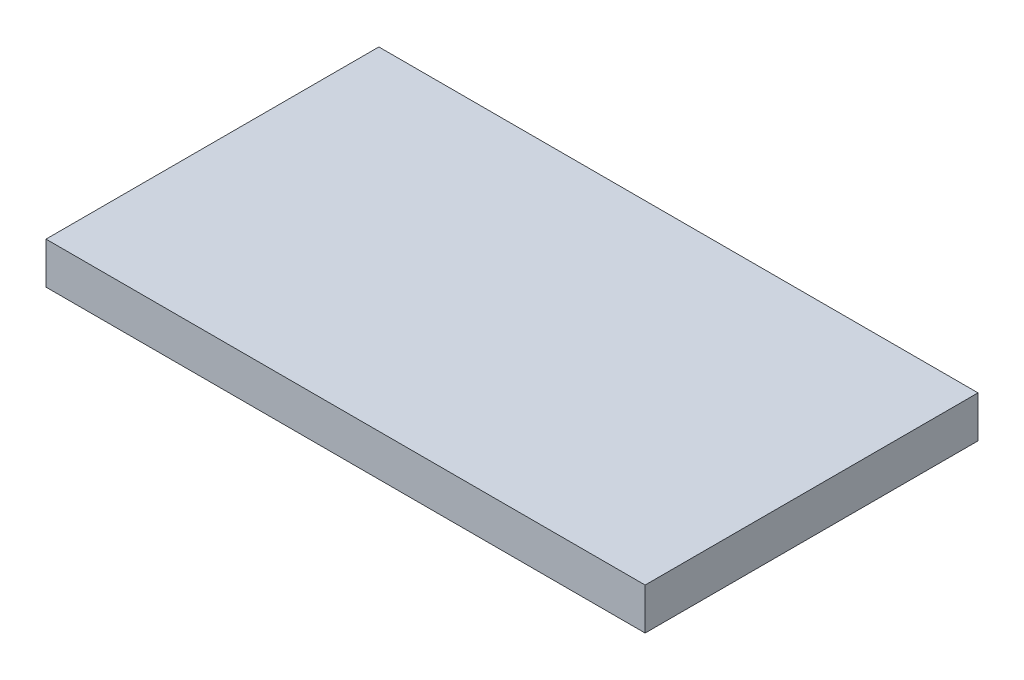
from build123d import *

# Parameters (mm, degrees)
SKETCH1_W           = 360
SKETCH1_H           = 200
BOSS_EXTRUDE1_DEPTH = 25


with BuildPart() as part:
    # Sketch1 → Boss-Extrude1 (new body)
    with BuildSketch(Plane(origin=(0, 0, 0), x_dir=(1, 0, 0), z_dir=(0, 1, 0))):
        with Locations((0, 100)):
            Rectangle(SKETCH1_W, SKETCH1_H)
    extrude(amount=-BOSS_EXTRUDE1_DEPTH)


solid = part.part
